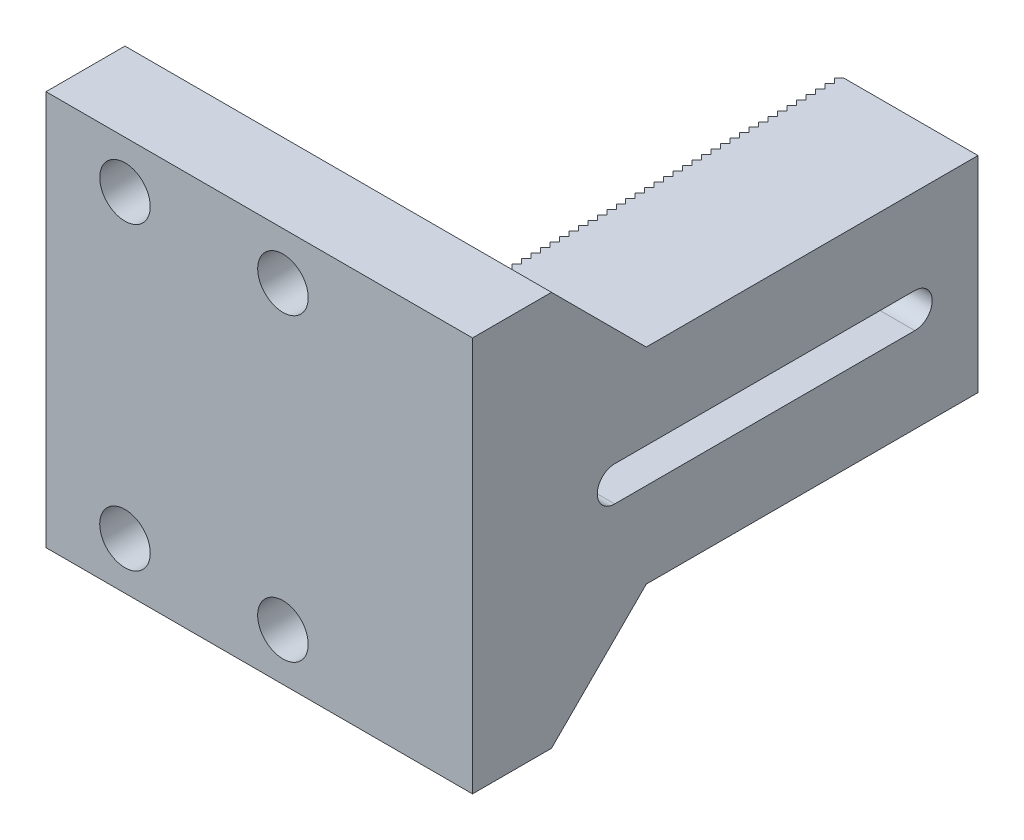
from build123d import *

# Parameters (mm, degrees)
EXTRUDE_1_DEPTH          = 25
SKETCH_4_R               = 1.6
CUT_EXTRUDE_2_DEPTH      = 49.764741361
CUT_EXTRUDE_5_DEPTH      = 45.833023543
EXTRUDE_2_DEPTH          = 13
CUT_EXTRUDE_4_DEPTH      = 10
CUT_EXTRUDE_4_DEPTH_BACK = 45.833023543


with BuildPart() as part:
    # 草图1 → 凸台-拉伸1 (new body)
    with BuildSketch(Plane(origin=(0, 0, 0), x_dir=(1, 0, 0), z_dir=(0, 1, 0))):
        Polygon((0, 0), (-27, 0), (-27, 5), (-8, 5), (-8, 32), (0, 32), align=None)
    extrude(amount=EXTRUDE_1_DEPTH)

    # 草图4 → 切除-拉伸2 (cut, through all)
    with BuildSketch(Plane.XY):
        with Locations((-22, 22)):
            Circle(SKETCH_4_R)
        with Locations((-12, 22)):
            Circle(SKETCH_4_R)
        with Locations((-22, 3)):
            Circle(SKETCH_4_R)
        with Locations((-12, 3)):
            Circle(SKETCH_4_R)
    extrude(amount=-CUT_EXTRUDE_2_DEPTH, mode=Mode.SUBTRACT)

    # 草图8 → 切除-拉伸5 (cut, through all)
    with BuildSketch(Plane.ZY.offset(8)):
        Polygon((-32, 19), (-11, 19), (-5, 25), (-32, 25), align=None)
        Polygon((-11, 6), (-5, 0), (-32, 0), (-32, 6), align=None)
    extrude(amount=-CUT_EXTRUDE_5_DEPTH, mode=Mode.SUBTRACT)

    # 草图11 → 凸台-拉伸2 (add)
    with BuildSketch(Plane.XZ.offset(-6)):
        Polygon((-8, -5), (-8, -32), (-8.5, -32), (-8.8, -31.7), (-8.5, -31.4), (-8.8, -31.1), (-8.5, -30.8), (-8.8, -30.5), (-8.5, -30.2), (-8.8, -29.9), (-8.5, -29.6), (-8.8, -29.3), (-8.5, -29), (-8.8, -28.7), (-8.5, -28.4), (-8.8, -28.1), (-8.5, -27.8), (-8.8, -27.5), (-8.5, -27.2), (-8.8, -26.9), (-8.5, -26.6), (-8.8, -26.3), (-8.5, -26), (-8.8, -25.7), (-8.5, -25.4), (-8.8, -25.1), (-8.5, -24.8), (-8.8, -24.5), (-8.5, -24.2), (-8.8, -23.9), (-8.5, -23.6), (-8.8, -23.3), (-8.5, -23), (-8.8, -22.7), (-8.5, -22.4), (-8.8, -22.1), (-8.5, -21.8), (-8.8, -21.5), (-8.5, -21.2), (-8.8, -20.9), (-8.5, -20.6), (-8.8, -20.3), (-8.5, -20), (-8.8, -19.7), (-8.5, -19.4), (-8.8, -19.1), (-8.5, -18.8), (-8.8, -18.5), (-8.5, -18.2), (-8.8, -17.9), (-8.5, -17.6), (-8.8, -17.3), (-8.5, -17), (-8.8, -16.7), (-8.5, -16.4), (-8.8, -16.1), (-8.5, -15.8), (-8.8, -15.5), (-8.5, -15.2), (-8.8, -14.9), (-8.5, -14.6), (-8.8, -14.3), (-8.5, -14), (-8.8, -13.7), (-8.5, -13.4), (-8.8, -13.1), (-8.5, -12.8), (-8.8, -12.5), (-8.5, -12.2), (-8.8, -11.9), (-8.5, -11.6), (-8.8, -11.3), (-8.5, -11), (-8.8, -10.7), (-8.5, -10.4), (-8.8, -10.1), (-8.5, -9.8), (-8.8, -9.5), (-8.5, -9.2), (-8.8, -8.9), (-8.5, -8.6), (-8.8, -8.3), (-8.5, -8), (-8.8, -7.7), (-8.5, -7.4), (-8.8, -7.1), (-8.5, -6.8), (-8.8, -6.5), (-8.5, -6.2), (-8.5, -5), align=None)
    extrude(amount=-EXTRUDE_2_DEPTH)

    # 草图6 → 切除-拉伸4 (cut, two sides: drawn at the far end of the back side and taken through both)
    with BuildSketch(Plane.ZY.offset(8).offset(-CUT_EXTRUDE_4_DEPTH_BACK)):
        with BuildLine():
            Line((-28, 13.6), (-9, 13.6))
            ThreePointArc((-9, 13.6), (-7.9, 12.5), (-9, 11.4))
            Line((-9, 11.4), (-28, 11.4))
            ThreePointArc((-28, 11.4), (-29.1, 12.5), (-28, 13.6))
        make_face()
    extrude(amount=CUT_EXTRUDE_4_DEPTH + CUT_EXTRUDE_4_DEPTH_BACK, mode=Mode.SUBTRACT)


solid = part.part
